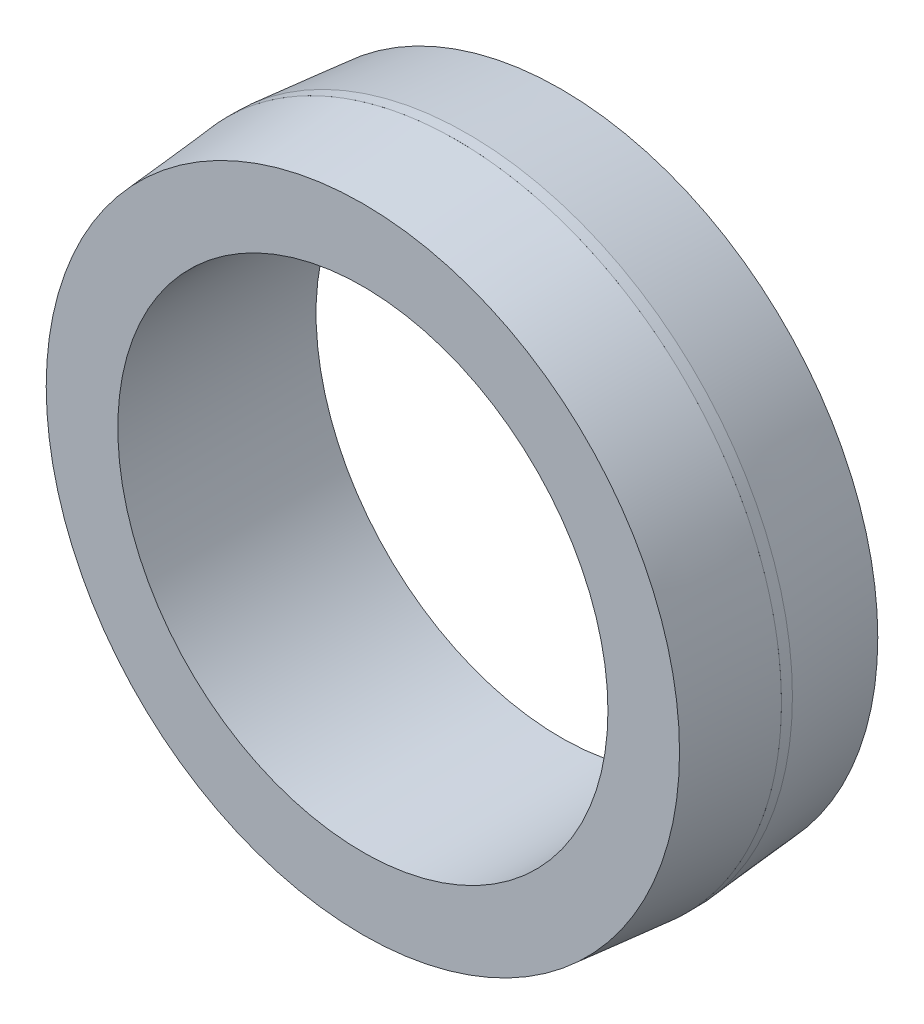
from build123d import *

# Parameters (mm, degrees)
SKETCH11_R          = 57.5
SKETCH11_R_2        = 44.5
BOSS_EXTRUDE3_DEPTH = 17
BOSS_EXTRUDE4_START = 1
SKETCH12_R          = 59
SKETCH12_R_2        = 44.5
BOSS_EXTRUDE4_DEPTH = 1
BOSS_EXTRUDE5_START = 17
SKETCH15_R          = 57.5
SKETCH15_R_2        = 44.5
BOSS_EXTRUDE5_DEPTH = 17


with BuildPart() as part:
    # Sketch10 → Revolve1 (revolve)
    with BuildSketch(Plane(origin=(0, 0, 0), x_dir=(1, 0, 0), z_dir=(0, 1, 0)), mode=Mode.PRIVATE) as revolve1_sk:
        Polygon((57.5, 17), (57.5, 0), (59, 0), align=None)
    revolve(revolve1_sk.sketch.rotate(Axis((0, 0, -66.869527167), (0, 0, 1)), 180), axis=Axis((0, 0, -66.869527167), (0, 0, 1)))

    # Sketch11 → Boss-Extrude3 (add)
    with BuildSketch(Plane.XY):
        Circle(SKETCH11_R)
        Circle(SKETCH11_R_2, mode=Mode.SUBTRACT)
    extrude(amount=-BOSS_EXTRUDE3_DEPTH)

    # Sketch12 → Boss-Extrude4 (add)
    with BuildSketch(Plane.XY.offset(BOSS_EXTRUDE4_START)):
        Circle(SKETCH12_R)
        Circle(SKETCH12_R_2, mode=Mode.SUBTRACT)
    boss_extrude4 = extrude(amount=-BOSS_EXTRUDE4_DEPTH)

    # Mirror11: Boss-Extrude4 across plane
    add(boss_extrude4.mirror(Plane.XY.offset(1)))

    # Sketch14 → Revolve2 (revolve)
    with BuildSketch(Plane(origin=(0, 0, 0), x_dir=(1, 0, 0), z_dir=(0, 1, 0)), mode=Mode.PRIVATE) as revolve2_sk:
        Polygon((-57.5, -2), (-57.5, -19), (-59, -1.968953878), align=None)
    revolve(revolve2_sk.sketch.rotate(Axis((0, 0, -34.208114596), (0, 0, 1)), 180), axis=Axis((0, 0, -34.208114596), (0, 0, 1)))

    # Sketch15 → Boss-Extrude5 (add)
    with BuildSketch(Plane.XY.offset(2).offset(BOSS_EXTRUDE5_START)):
        Circle(SKETCH15_R)
        Circle(SKETCH15_R_2, mode=Mode.SUBTRACT)
    extrude(amount=-BOSS_EXTRUDE5_DEPTH)


solid = part.part
